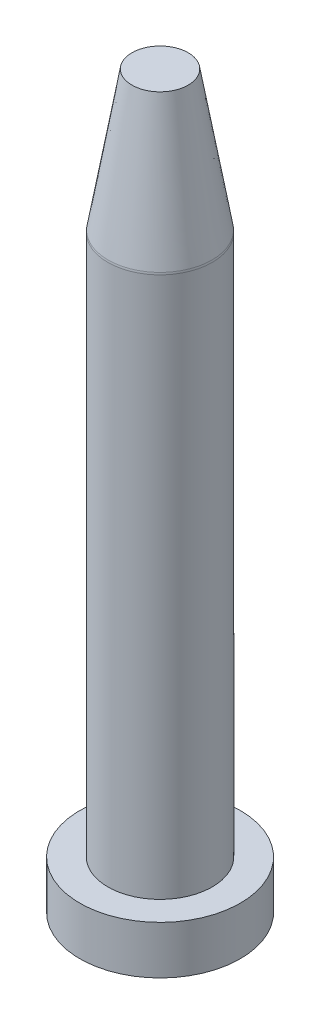
from build123d import *

# Parameters (mm, degrees)
FILLET_1_R = 3


with BuildPart() as part:
    # 草图1 → Revolve 292 (revolve)
    with BuildSketch(Plane.XY, mode=Mode.PRIVATE) as revolve_292_sk:
        Polygon((0, 0), (20, 0), (20, 12), (13, 12), (13, 147), (7, 182), (0, 182), align=None)
    revolve(revolve_292_sk.sketch.rotate(Axis((0, 0, 0), (0, 1, 0)), 90), axis=Axis((0, 0, 0), (0, 1, 0)))

    # 圆角1
    fillet_1_edges = [part.edges().sort_by_distance(p)[0] for p in [
        (0, 147, 13),
    ]]
    fillet(fillet_1_edges, radius=FILLET_1_R)


solid = part.part
